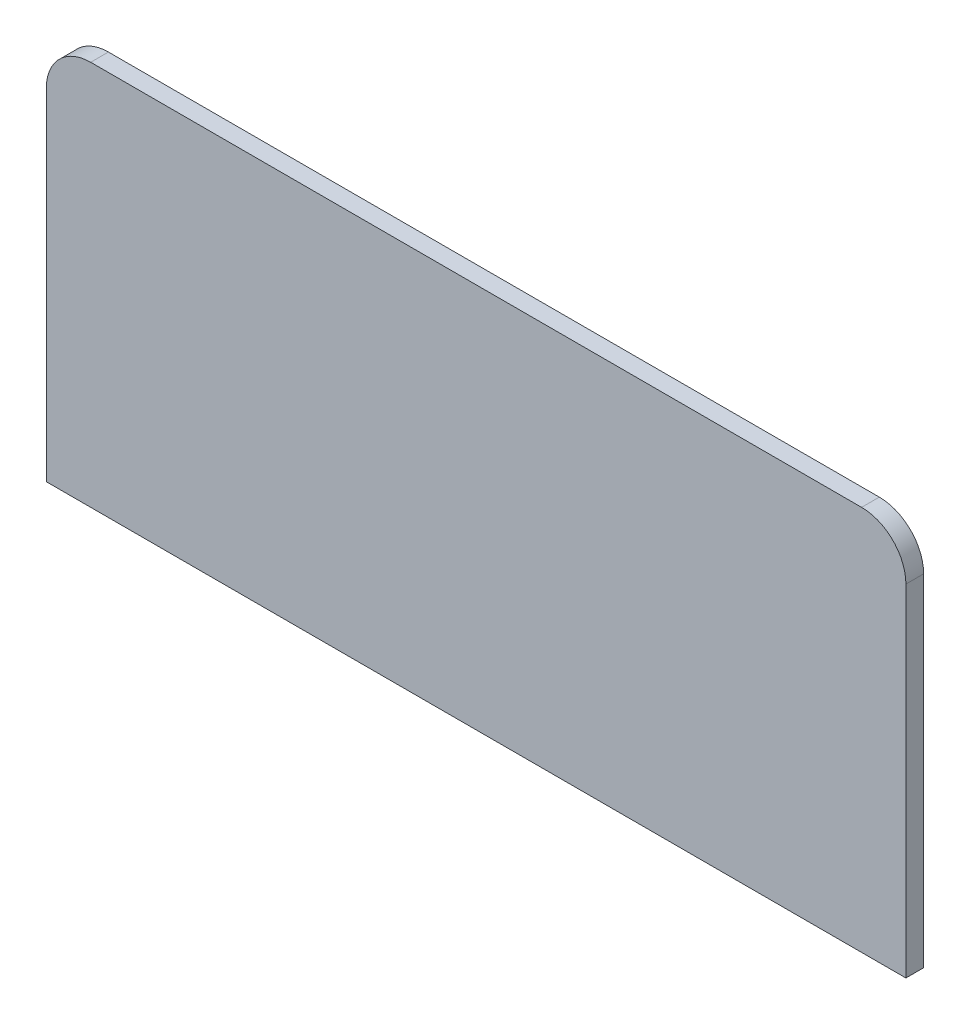
from build123d import *

# Parameters (mm, degrees)
SKETCH_1_W      = 194
SKETCH_1_H      = 87
EXTRUDE_1_DEPTH = 4
FILLET_1_R      = 10


with BuildPart() as part:
    # 草图1 → 凸台-拉伸1 (new body)
    with BuildSketch(Plane.XY):
        Rectangle(SKETCH_1_W, SKETCH_1_H)
    extrude(amount=EXTRUDE_1_DEPTH)

    # 圆角1
    fillet_1_edges = [part.edges().sort_by_distance(p)[0] for p in [
        (-97, 43.5, 2),
        (97, 43.5, 2),
    ]]
    fillet(fillet_1_edges, radius=FILLET_1_R)


solid = part.part
